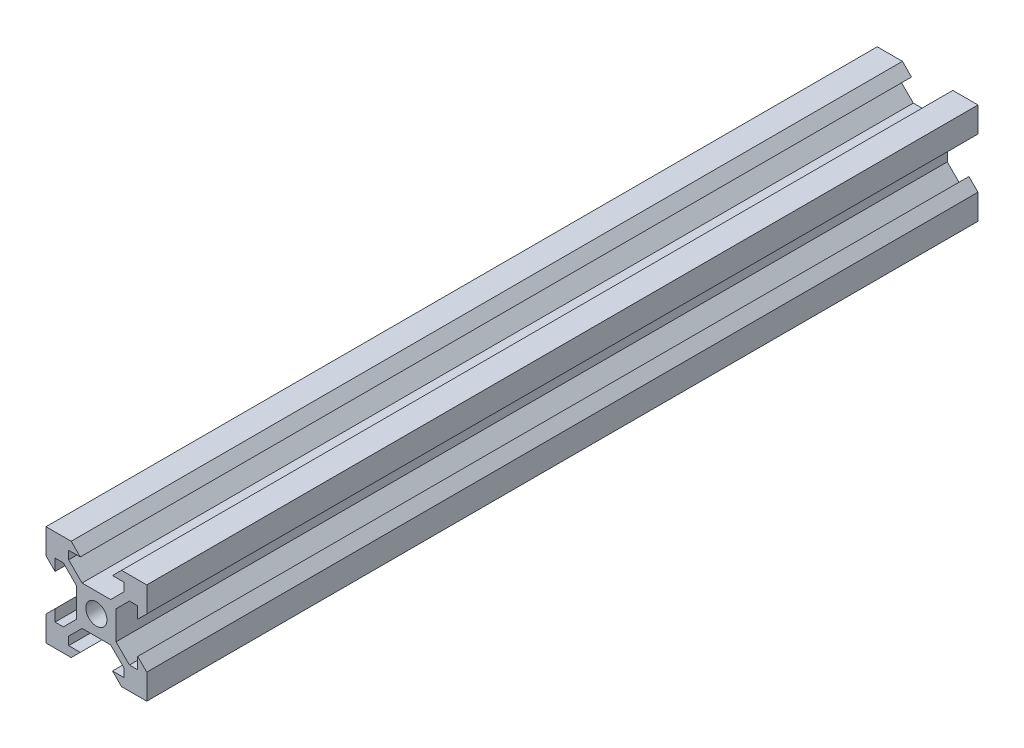
from build123d import *

# Parameters (mm, degrees)
SKETCH1_R           = 2.1
BOSS_EXTRUDE1_DEPTH = 165


with BuildPart() as part:
    # Sketch1 → Boss-Extrude1 (new body)
    with BuildSketch(Plane.XY):
        Polygon((-10, 10), (-10, 5), (-8.2, 3.2), (-8.2, 5.499339828), (-6.56, 5.499339828), (-3.900660172, 2.84), (-3.900660172, -2.84), (-6.56, -5.499339828), (-8.2, -5.499339828), (-8.2, -3.2), (-10, -5), (-10, -10), (-5, -10), (-3.2, -8.2), (-5.499339828, -8.2), (-5.499339828, -6.56), (-2.84, -3.900660172), (2.84, -3.900660172), (5.499339828, -6.56), (5.499339828, -8.2), (3.2, -8.2), (5, -10), (10, -10), (10, -5), (8.2, -3.2), (8.2, -5.499339828), (6.56, -5.499339828), (3.900660172, -2.84), (3.900660172, 2.84), (6.56, 5.499339828), (8.2, 5.499339828), (8.2, 3.2), (10, 5), (10, 10), (5, 10), (3.2, 8.2), (5.499339828, 8.2), (5.499339828, 6.56), (2.84, 3.900660172), (-2.84, 3.900660172), (-5.499339828, 6.56), (-5.499339828, 8.2), (-3.2, 8.2), (-5, 10), align=None)
        Circle(SKETCH1_R, mode=Mode.SUBTRACT)
    extrude(amount=-BOSS_EXTRUDE1_DEPTH)


solid = part.part
